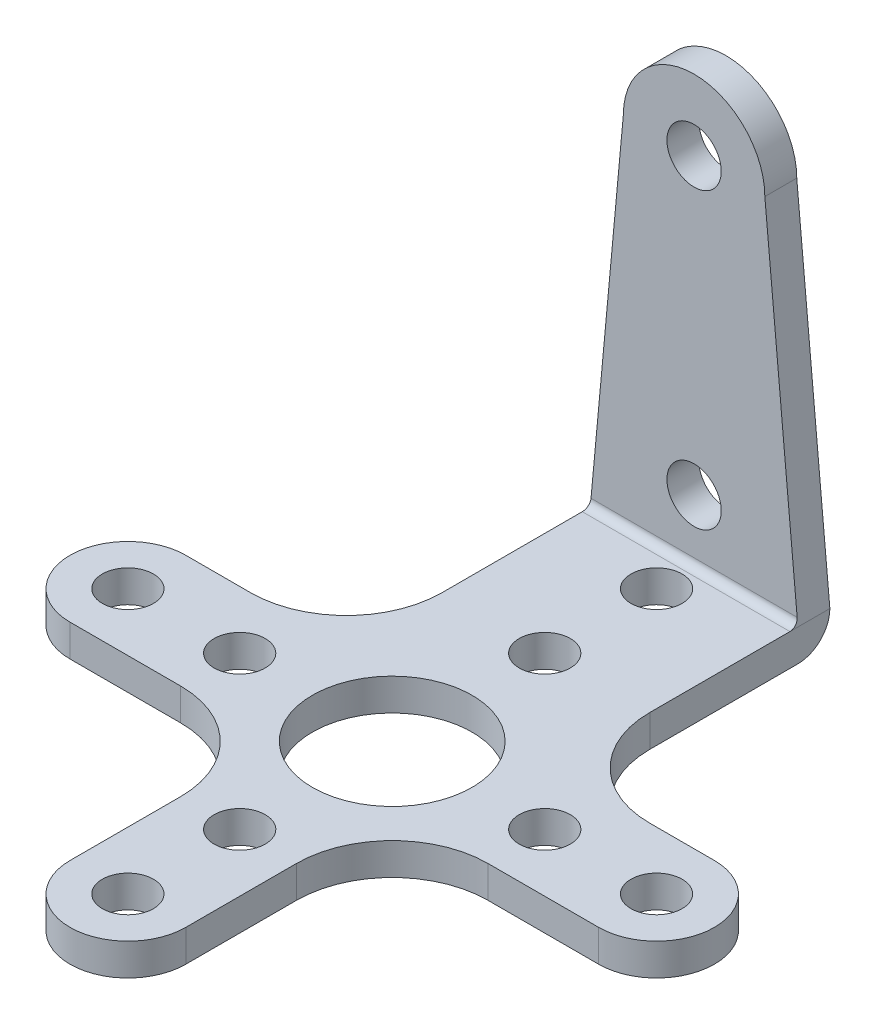
from build123d import *

# Parameters (mm, degrees)
ESQUISSE1_R        = 5
ESQUISSE1_R_2      = 1.6
BOSS_EXTRU_1_DEPTH = 2
ESQUISSE2_R        = 1.7
BOSS_EXTRU_2_DEPTH = 2
CONG_2_R           = 2
CONG_3_R           = 0.5


with BuildPart() as part:
    # Esquisse1 → Boss.-Extru.1 (new body)
    with BuildSketch(Plane(origin=(0, 0, 0), x_dir=(1, 0, 0), z_dir=(0, 1, 0))):
        with BuildLine():
            Line((-16.55, 3.625), (-12.5, 3.625))
            ThreePointArc((-12.5, 3.625), (-8.257359313, 5.382359313), (-6.5, 9.625))
            Line((-6.5, 9.625), (-6.5, 18.9))
            Line((-6.5, 18.9), (6.5, 18.9))
            Line((6.5, 18.9), (6.5, 9.625))
            ThreePointArc((6.5, 9.625), (8.257359313, 5.382359313), (12.5, 3.625))
            Line((12.5, 3.625), (16.55, 3.625))
            ThreePointArc((16.55, 3.625), (20.175, 0), (16.55, -3.625))
            Line((16.55, -3.625), (9.625, -3.625))
            ThreePointArc((9.625, -3.625), (5.382359313, -5.382359313), (3.625, -9.625))
            Line((3.625, -9.625), (3.625, -16.55))
            ThreePointArc((3.625, -16.55), (0, -20.175), (-3.625, -16.55))
            Line((-3.625, -16.55), (-3.625, -9.625))
            ThreePointArc((-3.625, -9.625), (-5.382359313, -5.382359313), (-9.625, -3.625))
            Line((-9.625, -3.625), (-16.55, -3.625))
            ThreePointArc((-16.55, -3.625), (-20.175, 0), (-16.55, 3.625))
        make_face()
        with Locations(Location((0, 0, 0), (0, 0, 270))):
            Circle(ESQUISSE1_R, mode=Mode.SUBTRACT)
        with Locations(Location((-9.55, 0, 0), (0, 0, 270))):
            Circle(ESQUISSE1_R_2, mode=Mode.SUBTRACT)
        with Locations(Location((-16.55, 0, 0), (0, 0, 270))):
            Circle(ESQUISSE1_R_2, mode=Mode.SUBTRACT)
        with Locations(Location((9.55, 0, 0), (0, 0, 90))):
            Circle(ESQUISSE1_R_2, mode=Mode.SUBTRACT)
        with Locations(Location((16.55, 0, 0), (0, 0, 90))):
            Circle(ESQUISSE1_R_2, mode=Mode.SUBTRACT)
        with Locations(Location((0, -9.55, 0), (0, 0, 90))):
            Circle(ESQUISSE1_R_2, mode=Mode.SUBTRACT)
        with Locations(Location((0, -16.55, 0), (0, 0, 90))):
            Circle(ESQUISSE1_R_2, mode=Mode.SUBTRACT)
        with Locations(Location((0, 16.55, 0), (0, 0, 270))):
            Circle(ESQUISSE1_R_2, mode=Mode.SUBTRACT)
        with Locations(Location((0, 9.55, 0), (0, 0, 270))):
            Circle(ESQUISSE1_R_2, mode=Mode.SUBTRACT)
    extrude(amount=BOSS_EXTRU_1_DEPTH)

    # Esquisse2 → Boss.-Extru.2 (add)
    with BuildSketch(Plane(origin=(0, 0, -18.9), x_dir=(-1, 0, 0), z_dir=(0, 0, -1))):
        with BuildLine():
            Line((-6.5, 0), (6.5, 0))
            Line((6.5, 0), (6.5, 2))
            Line((6.5, 2), (4.429285714, 24.3))
            ThreePointArc((4.429285714, 24.3), (0, 28.729285714), (-4.429285714, 24.3))
            Line((-4.429285714, 24.3), (-6.5, 2))
            Line((-6.5, 2), (-6.5, 0))
        make_face()
        with Locations((0, 24.3)):
            Circle(ESQUISSE2_R, mode=Mode.SUBTRACT)
        with Locations((0, 5.9)):
            Circle(ESQUISSE2_R, mode=Mode.SUBTRACT)
    extrude(amount=BOSS_EXTRU_2_DEPTH)

    # Congé2
    cong_2_edges = [part.edges().sort_by_distance(p)[0] for p in [
        (0, 0, -20.9),
    ]]
    fillet(cong_2_edges, radius=CONG_2_R)

    # Congé3
    cong_3_edges = [part.edges().sort_by_distance(p)[0] for p in [
        (0, 2, -18.9),
    ]]
    fillet(cong_3_edges, radius=CONG_3_R)


solid = part.part
